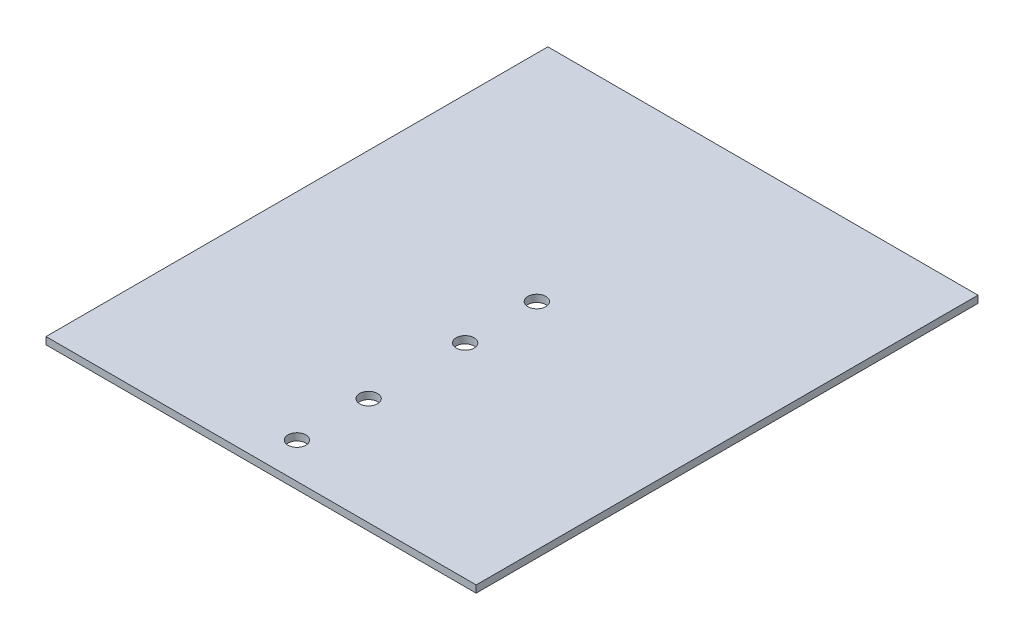
from build123d import *

# Parameters (mm, degrees)
SKETCH1_W                   = 152.4
SKETCH1_H                   = 177.8
BOSS_EXTRUDE1_DEPTH         = 2.54
F_1_4_0_25_DIAMETER_HOLE1_D = 6.35


with BuildPart() as part:
    # Sketch1 → Boss-Extrude1 (new body)
    with BuildSketch(Plane(origin=(0, 0, 0), x_dir=(1, 0, 0), z_dir=(0, 1, 0))):
        Rectangle(SKETCH1_W, SKETCH1_H)
    extrude(amount=BOSS_EXTRUDE1_DEPTH)

    # 1/4 (0.25) Diameter Hole1 (through all)
    with Locations(Plane(origin=(0, 0, 0), x_dir=(-1, 0, 0), z_dir=(0, -1, 0))):
        with Locations((0, -76.2), (0, -50.8), (0, 8.799184965), (0, -16.600815035)):
            Hole(F_1_4_0_25_DIAMETER_HOLE1_D / 2)


solid = part.part
